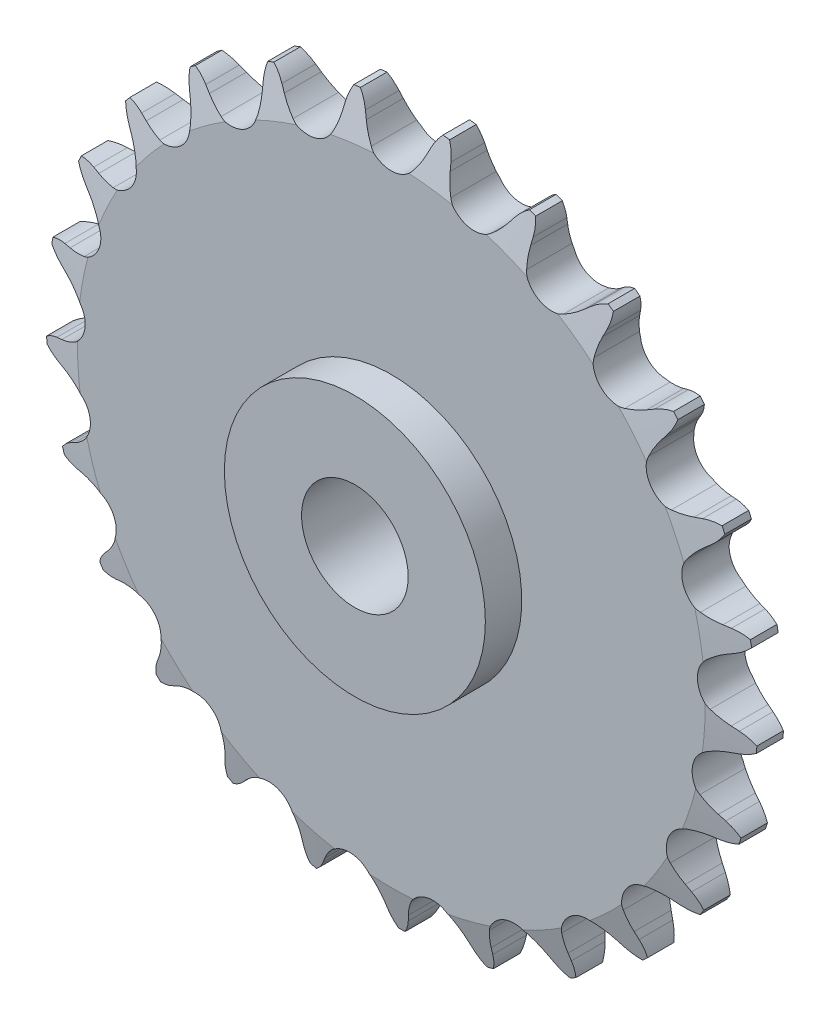
from build123d import *

# Parameters (mm, degrees)
CUT_EXTRUDE1_DEPTH      = 77.559208195
CIRPATTERN1_COUNT       = 25
SKETCH2_R               = 19.84375
BOSS_EXTRUDE1_DEPTH     = 9.144
CUT_EXTRUDE2_DEPTH      = 77.96466411
CUT_EXTRUDE2_DEPTH_BACK = 77.96466411
SKETCH3_R               = 8.1026


with BuildPart() as part:
    # Sketch1 → Revolve1 (revolve)
    with BuildSketch(Plane(origin=(0, 0, 0), x_dir=(0, 0, -1), z_dir=(1, 0, 0)), mode=Mode.PRIVATE) as revolve1_sk:
        Polygon((-3.6068, 0), (3.6068, 0), (3.6068, 47.725425811), (2.0193, 54.075425811), (-2.0193, 54.075425811), (-3.6068, 47.725425811), align=None)
    revolve(revolve1_sk.sketch.rotate(Axis((0, 0, 3.6068), (0, 0, -1)), 90), axis=Axis((0, 0, 3.6068), (0, 0, -1)))

    # Sketch0 → Cut-Extrude1 (cut, symmetric)
    with BuildSketch(Plane.XY):
        with BuildLine():
            Line((11.414975913, -50.634704869), (10.91105258, -49.719585641))
            ThreePointArc((10.91105258, -49.719585641), (10.140224594, -48.522577316), (9.212566857, -47.442551466))
            ThreePointArc((9.212566857, -47.442551466), (5.846121297, -46.276815172), (2.875345642, -48.243128683))
            ThreePointArc((2.875345642, -48.243128683), (2.245423486, -49.519922633), (1.796496344, -50.871021865))
            Line((1.796496344, -50.871021865), (1.535985586, -51.882711576))
            ThreePointArc((1.535985586, -51.882711576), (-1.016970384, -55.572662258), (-5.354207032, -56.72231372))
            ThreePointArc((-5.354207032, -56.72231372), (7.140792548, -56.525193396), (19.292260571, -53.608740786))
            ThreePointArc((19.292260571, -53.608740786), (14.805379496, -53.573834632), (11.414975913, -50.634704869))
        make_face()
    cut_extrude1 = extrude(amount=CUT_EXTRUDE1_DEPTH, both=True, mode=Mode.SUBTRACT)

    # CirPattern1: Cut-Extrude1 ×25 about axis
    cirpattern1_axis = Axis((0, 0, 0), (0, 0, 1))
    for i in range(1, CIRPATTERN1_COUNT):
        add(cut_extrude1.rotate(cirpattern1_axis, i * 360 / CIRPATTERN1_COUNT), mode=Mode.SUBTRACT)

    # Sketch2 → Boss-Extrude1 (add, symmetric)
    with BuildSketch(Plane.XY):
        Circle(SKETCH2_R)
    extrude(amount=BOSS_EXTRUDE1_DEPTH, both=True)

    # Sketch3 → Cut-Extrude2 (cut, two sides: drawn at the far end of the back side and taken through both)
    with BuildSketch(Plane.XY.offset(-CUT_EXTRUDE2_DEPTH_BACK)):
        Circle(SKETCH3_R)
    extrude(amount=CUT_EXTRUDE2_DEPTH + CUT_EXTRUDE2_DEPTH_BACK, mode=Mode.SUBTRACT)


solid = part.part
